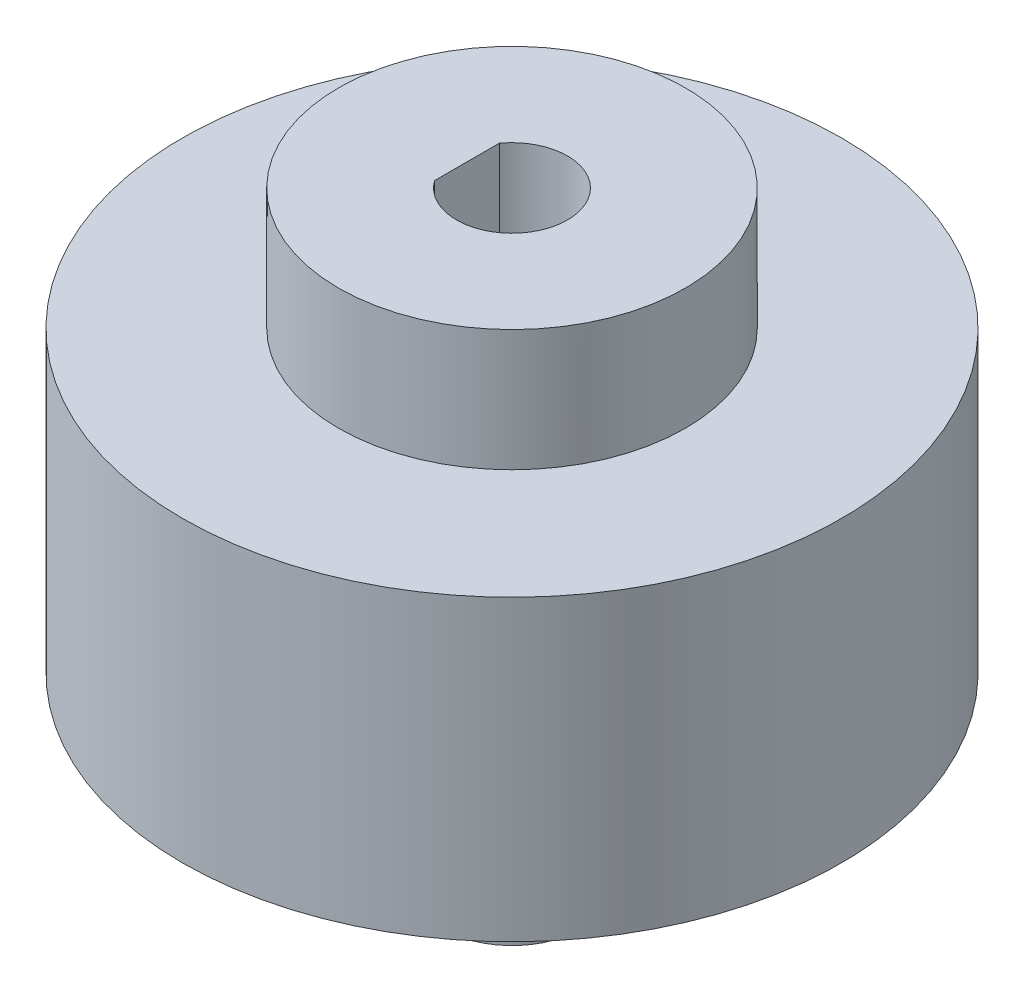
from build123d import *

# Parameters (mm, degrees)
ESQUISSE1_R             = 4
BOSS_EXTRU_1_DEPTH      = 35
ESQUISSE2_R             = 3.2
ENL_V_MAT_EXTRU_1_DEPTH = 13
BOSS_EXTRU_2_START      = 13
BOSS_EXTRU_2_DEPTH      = 13
ESQUISSE5_R             = 10
ESQUISSE5_R_2           = 4
BOSS_EXTRU_3_DEPTH      = 7
SKETCH2_R               = 16.2
SKETCH2_R_2             = 4
BOSS_EXTRUDE4_DEPTH     = 3
SKETCH2_8_R             = 19
SKETCH2_8_R_2           = 16.2
BOSS_EXTRUDE5_DEPTH     = 17.2
SKETCH4_R               = 3
CUT_EXTRUDE1_DEPTH      = 10


with BuildPart() as part:
    # Esquisse1 → Boss.-Extru.1 (new body)
    with BuildSketch(Plane(origin=(0, 0, 0), x_dir=(1, 0, 0), z_dir=(0, 1, 0))):
        Circle(ESQUISSE1_R)
    extrude(amount=-BOSS_EXTRU_1_DEPTH)

    # Esquisse2 → Enlèv. mat.-Extru.1 (cut)
    with BuildSketch(Plane(origin=(0, 0, 0), x_dir=(1, 0, 0), z_dir=(0, 1, 0))):
        Circle(ESQUISSE2_R)
    extrude(amount=-ENL_V_MAT_EXTRU_1_DEPTH, mode=Mode.SUBTRACT)

    # Esquisse4 → Boss.-Extru.2 (add)
    with BuildSketch(Plane(origin=(0, -13, 0), x_dir=(1, 0, 0), z_dir=(0, 1, 0)).offset(BOSS_EXTRU_2_START)):
        with BuildLine():
            Line((-2.6, -1.865475811), (-2.6, 0))
            Line((-2.6, 0), (-2.6, 1.865475811))
            ThreePointArc((-2.6, 1.865475811), (-3.2, 0), (-2.6, -1.865475811))
        make_face()
    extrude(amount=-BOSS_EXTRU_2_DEPTH)

    # Esquisse5 → Boss.-Extru.3 (add)
    with BuildSketch(Plane(origin=(0, 0, 0), x_dir=(1, 0, 0), z_dir=(0, 1, 0))):
        Circle(ESQUISSE5_R)
        Circle(ESQUISSE5_R_2, mode=Mode.SUBTRACT)
    extrude(amount=-BOSS_EXTRU_3_DEPTH)

    # Sketch2 → Boss-Extrude4 (add)
    with BuildSketch(Plane.XZ.offset(7)):
        Circle(SKETCH2_R)
        Circle(SKETCH2_R_2, mode=Mode.SUBTRACT)
    extrude(amount=BOSS_EXTRUDE4_DEPTH)

    # Sketch2<8> → Boss-Extrude5 (add)
    with BuildSketch(Plane.XZ.offset(7)):
        Circle(SKETCH2_8_R)
        Circle(SKETCH2_8_R_2, mode=Mode.SUBTRACT)
    extrude(amount=BOSS_EXTRUDE5_DEPTH)

    # Sketch4 → Cut-Extrude1 (cut)
    with BuildSketch(Plane(origin=(0, 0, -19), x_dir=(-1, 0, 0), z_dir=(0, 0, -1))):
        with Locations((0, -16.6)):
            Circle(SKETCH4_R)
    extrude(amount=-CUT_EXTRUDE1_DEPTH, mode=Mode.SUBTRACT)


solid = part.part
